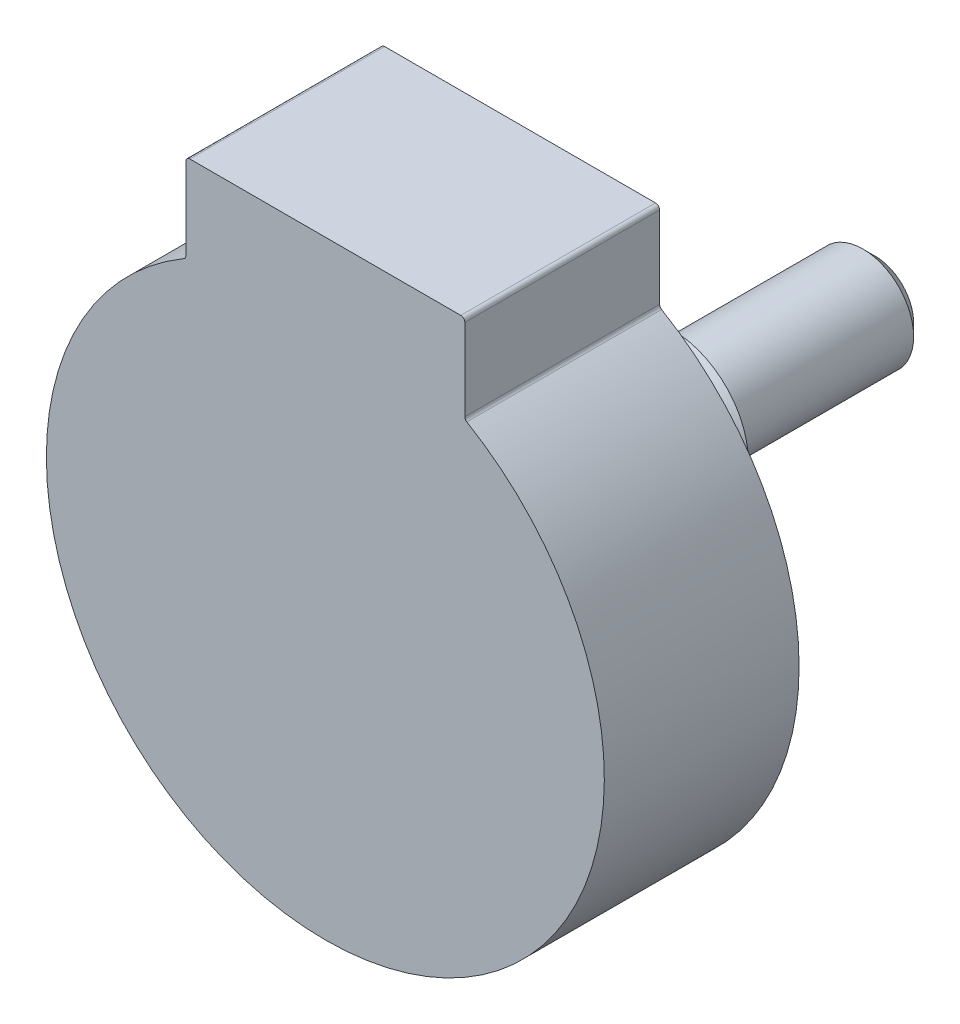
from build123d import *

# Parameters (mm, degrees)
EXTRUDE1_DEPTH      = 12.192
EXTRUDE3_DEPTH      = 1.27
CHAMFER1_SIZE       = 0.762
FILLET1_R           = 0.254
BOSS_EXTRUDE1_START = 1.905
BOSS_EXTRUDE1_DEPTH = 1.905


with BuildPart() as part:
    # Sketch1 → Extrude1 (new body)
    with BuildSketch(Plane.XY):
        with BuildLine():
            Line((-8.73125, 15.122968614), (-8.73125, 20.6375))
            Line((-8.73125, 20.6375), (8.73125, 20.6375))
            Line((8.73125, 20.6375), (8.73125, 15.122968614))
            ThreePointArc((8.73125, 15.122968614), (0, -17.4625), (-8.73125, 15.122968614))
        make_face()
    extrude(amount=EXTRUDE1_DEPTH)



with BuildPart() as body_2:
    # Sketch3 → Extrude3 (new body)
    with BuildSketch(Plane(origin=(0, 0, 0), x_dir=(-1, 0, 0), z_dir=(0, 0, -1))):
        Polygon((3.175, 1.833087105), (0, 3.666174209), (-3.175, 1.833087105), (-3.175, -1.833087105), (0, -3.666174209), (3.175, -1.833087105), align=None)
    extrude(amount=EXTRUDE3_DEPTH)


with BuildPart() as part_1:
    add(part.part)

    add(body_2.part)  # Revolve1 merges body 2
    # Sketch5 → Revolve1 (revolve)
    with BuildSketch(Plane(origin=(0, 0, 0), x_dir=(1, 0, 0), z_dir=(0, 1, 0))):
        Polygon((0, 0), (0, 22.225), (3.16865, 22.225), (3.16865, 9.525), (4.7625, 9.525), (4.318, 9.128125), (4.7625, 8.73125), (4.318, 8.334375), (4.7625, 7.9375), (4.318, 7.540625), (4.7625, 7.14375), (4.318, 6.746875), (4.7625, 6.35), (4.318, 5.953125), (4.7625, 5.55625), (4.318, 5.159375), (4.7625, 4.7625), (4.318, 4.365625), (4.7625, 3.96875), (4.318, 3.571875), (4.7625, 3.175), (4.318, 2.778125), (4.7625, 2.38125), (4.318, 1.984375), (4.7625, 1.5875), (4.318, 1.190625), (4.7625, 0.79375), (4.318, 0.396875), (4.7625, 0), align=None)
    revolve(axis=Axis((0, 0, 0), (0, 0, -1)))

    # Chamfer1
    chamfer1_edges = [part_1.edges().sort_by_distance(p)[0] for p in [
        (-3.16865, 0, -22.225),
    ]]
    chamfer(chamfer1_edges, length=CHAMFER1_SIZE)

    # Fillet1
    fillet1_edges = [part_1.edges().sort_by_distance(p)[0] for p in [
        (-8.73125, 15.122968614, 6.096),
        (-8.73125, 20.6375, 6.096),
        (8.73125, 20.6375, 6.096),
        (8.73125, 15.122968614, 6.096),
    ]]
    fillet(fillet1_edges, radius=FILLET1_R)

    # Sketch6 → Boss-Extrude1 (add)
    with BuildSketch(Plane(origin=(0, 0, 0), x_dir=(-1, 0, 0), z_dir=(0, 0, -1)).offset(BOSS_EXTRUDE1_START)):
        with BuildLine():
            ThreePointArc((17.173863636, 3.161852946), (14.2875, 0), (17.173863636, -3.161852946))
            ThreePointArc((17.173863636, -3.161852946), (17.4625, 0), (17.173863636, 3.161852946))
        make_face()
    extrude(amount=-BOSS_EXTRUDE1_DEPTH)


solid = part_1.part
